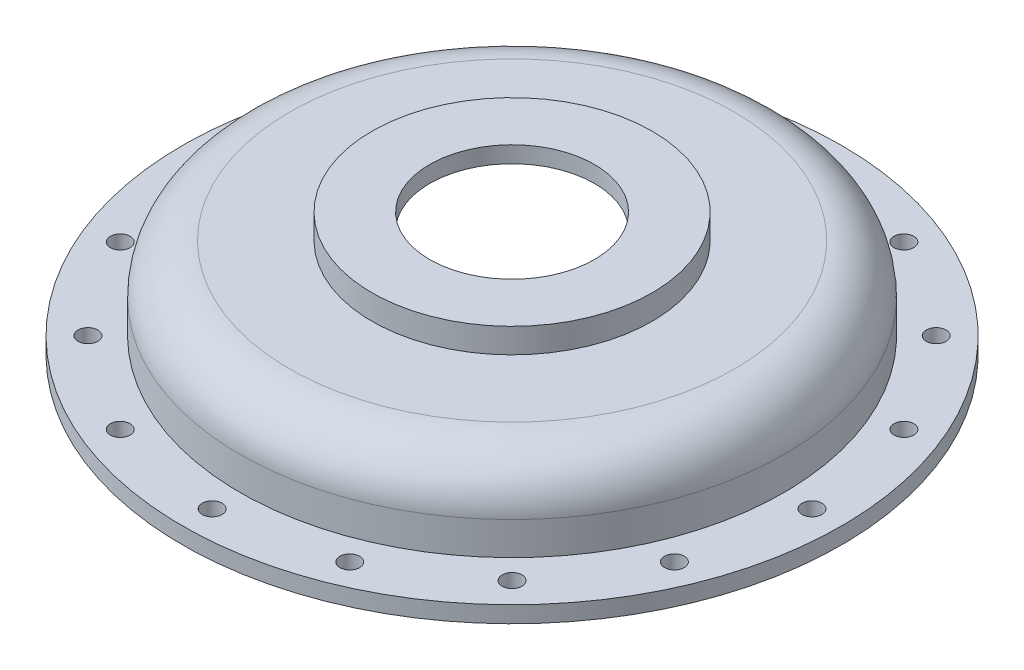
from build123d import *

# Parameters (mm, degrees)
SKETCH3_R          = 6
CUT_EXTRUDE1_DEPTH = 291.215437219
CIRPATTERN1_COUNT  = 16
SKETCH4_R          = 50
CUT_EXTRUDE2_DEPTH = 293.617497768


with BuildPart() as part:
    # Sketch2 → Revolve1 (revolve)
    with BuildSketch(Plane.XY, mode=Mode.PRIVATE) as revolve1_sk:
        with BuildLine():
            Line((155, -56.568542495), (200, -56.568542495))
            Line((200, -56.568542495), (200, -46.568542495))
            Line((200, -46.568542495), (165, -46.568542495))
            Line((165, -46.568542495), (165, -26.568542495))
            ThreePointArc((165, -26.568542495), (156.213203436, -5.355339059), (135, 3.431457505))
            Line((135, 3.431457505), (85, 3.431457505))
            Line((85, 3.431457505), (85, 18.431457505))
            Line((85, 18.431457505), (0, 18.431457505))
            Line((0, 18.431457505), (0, 8.431457505))
            Line((0, 8.431457505), (75, 8.431457505))
            Line((75, 8.431457505), (75, -6.568542495))
            Line((75, -6.568542495), (134.255065141, -6.568542495))
            ThreePointArc((134.255065141, -6.568542495), (148.662982429, -12.382785273), (155, -26.568542495))
            Line((155, -26.568542495), (155, -56.568542495))
        make_face()
    revolve(revolve1_sk.sketch.rotate(Axis((0, 0, 0), (0, 1, 0)), 90), axis=Axis((0, 0, 0), (0, 1, 0)))

    # Sketch3 → Cut-Extrude1 (cut, through all)
    with BuildSketch(Plane(origin=(0, -46.568542495, 0), x_dir=(1, 0, 0), z_dir=(0, 1, 0))):
        with Locations(Location((0, 182, 0), (0, 0, 270))):
            Circle(SKETCH3_R)
    cut_extrude1 = extrude(amount=-CUT_EXTRUDE1_DEPTH, mode=Mode.SUBTRACT)

    # CirPattern1: Cut-Extrude1 ×16 about axis
    cirpattern1_axis = Axis((0, 0, 0), (0, 1, 0))
    for i in range(1, CIRPATTERN1_COUNT):
        add(cut_extrude1.rotate(cirpattern1_axis, i * 360 / CIRPATTERN1_COUNT), mode=Mode.SUBTRACT)

    # Sketch4 → Cut-Extrude2 (cut, through all)
    with BuildSketch(Plane(origin=(0, 18.431457505, 0), x_dir=(1, 0, 0), z_dir=(0, 1, 0))):
        with Locations(Location((0, 0, 0), (0, 0, 270))):
            Circle(SKETCH4_R)
    extrude(amount=-CUT_EXTRUDE2_DEPTH, mode=Mode.SUBTRACT)


solid = part.part
